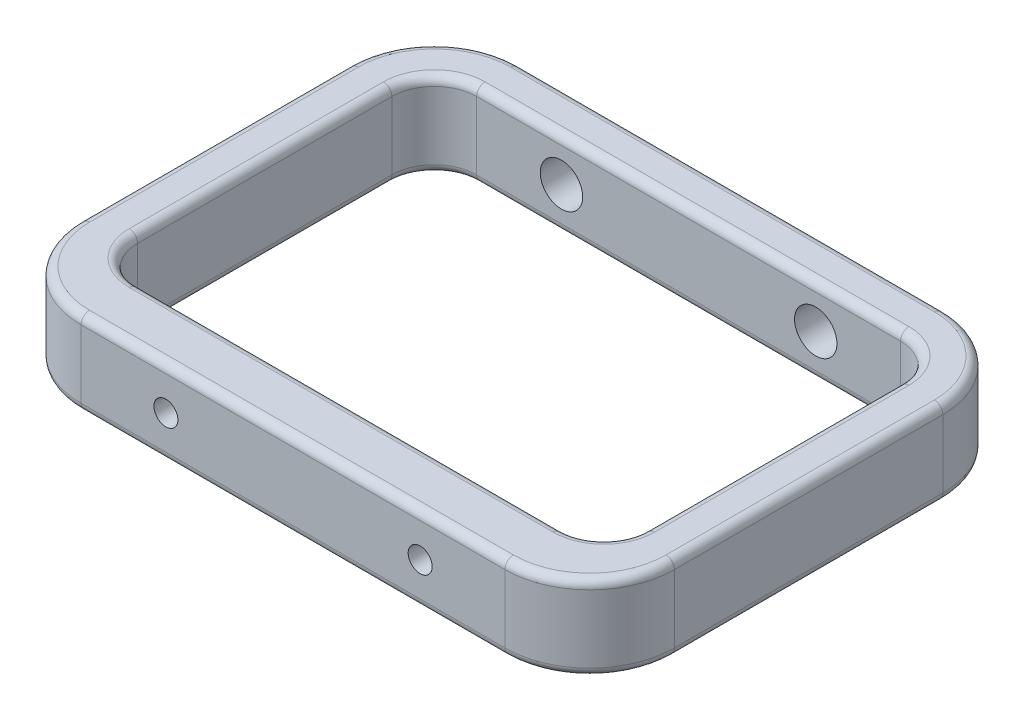
from build123d import *

# Parameters (mm, degrees)
BOSS_EXTRUDE1_DEPTH      = 15
BOSS_EXTRUDE1_DEPTH_BACK = 15
SKETCH2_R                = 4.25
CUT_EXTRUDE1_DEPTH       = 120
SKETCH3_R                = 7.5
CUT_EXTRUDE2_DEPTH       = 142
FILLET1_R                = 3


with BuildPart() as part:
    # Sketch1 → Boss-Extrude1 (new, two sides: drawn at the far end of the back side and taken through both)
    with BuildSketch(Plane(origin=(0, 0, 0), x_dir=(1, 0, 0), z_dir=(0, 1, 0)).offset(-BOSS_EXTRUDE1_DEPTH_BACK)):
        with BuildLine():
            Line((-75, 0), (75, 0))
            ThreePointArc((75, 0), (96.213203436, 8.786796564), (105, 30))
            Line((105, 30), (105, 125))
            ThreePointArc((105, 125), (96.213203436, 146.213203436), (75, 155))
            Line((75, 155), (-75, 155))
            ThreePointArc((-75, 155), (-96.213203436, 146.213203436), (-105, 125))
            Line((-105, 125), (-105, 30))
            ThreePointArc((-105, 30), (-96.213203436, 8.786796564), (-75, 0))
        make_face()
        with BuildLine():
            Line((-75, 140), (75, 140))
            ThreePointArc((75, 140), (85.606601718, 135.606601718), (90, 125))
            Line((90, 125), (90, 35))
            ThreePointArc((90, 35), (85.606601718, 24.393398282), (75, 20))
            Line((75, 20), (-75, 20))
            ThreePointArc((-75, 20), (-85.606601718, 24.393398282), (-90, 35))
            Line((-90, 35), (-90, 125))
            ThreePointArc((-90, 125), (-85.606601718, 135.606601718), (-75, 140))
        make_face(mode=Mode.SUBTRACT)
    extrude(amount=BOSS_EXTRUDE1_DEPTH + BOSS_EXTRUDE1_DEPTH_BACK)

    # Sketch2 → Cut-Extrude1 (cut)
    with BuildSketch(Plane.XY):
        with Locations((45, 0)):
            Circle(SKETCH2_R)
        with Locations((-45, 0)):
            Circle(SKETCH2_R)
    extrude(amount=-CUT_EXTRUDE1_DEPTH, mode=Mode.SUBTRACT)

    # Sketch3 → Cut-Extrude2 (cut)
    with BuildSketch(Plane(origin=(0, 0, -155), x_dir=(-1, 0, 0), z_dir=(0, 0, -1))):
        with Locations((45, 0)):
            Circle(SKETCH3_R)
        with Locations((-45, 0)):
            Circle(SKETCH3_R)
    extrude(amount=-CUT_EXTRUDE2_DEPTH, mode=Mode.SUBTRACT)

    # Fillet1
    fillet1_edges = [part.edges().sort_by_distance(p)[0] for p in [
        (-85.606601718, -15, -135.606601718),
        (0, -15, -140),
        (85.606601718, -15, -135.606601718),
        (90, -15, -80),
        (85.606601718, -15, -24.393398282),
        (0, -15, -20),
        (-85.606601718, -15, -24.393398282),
        (-105, -15, -77.5),
        (-96.213203436, -15, -146.213203436),
        (0, -15, -155),
        (96.213203436, -15, -146.213203436),
        (105, -15, -77.5),
        (96.213203436, -15, -8.786796564),
        (0, -15, 0),
        (85.606601718, 15, -24.393398282),
        (0, 15, -20),
        (-85.606601718, 15, -24.393398282),
        (-90, 15, -80),
        (-85.606601718, 15, -135.606601718),
        (0, 15, -140),
        (85.606601718, 15, -135.606601718),
        (96.213203436, 15, -146.213203436),
        (105, 15, -77.5),
        (96.213203436, 15, -8.786796564),
        (0, 15, 0),
        (-96.213203436, 15, -8.786796564),
        (-105, 15, -77.5),
        (-96.213203436, 15, -146.213203436),
        (-90, -15, -80),
        (-96.213203436, -15, -8.786796564),
        (90, 15, -80),
        (0, 15, -155),
    ]]
    fillet(fillet1_edges, radius=FILLET1_R)


solid = part.part
